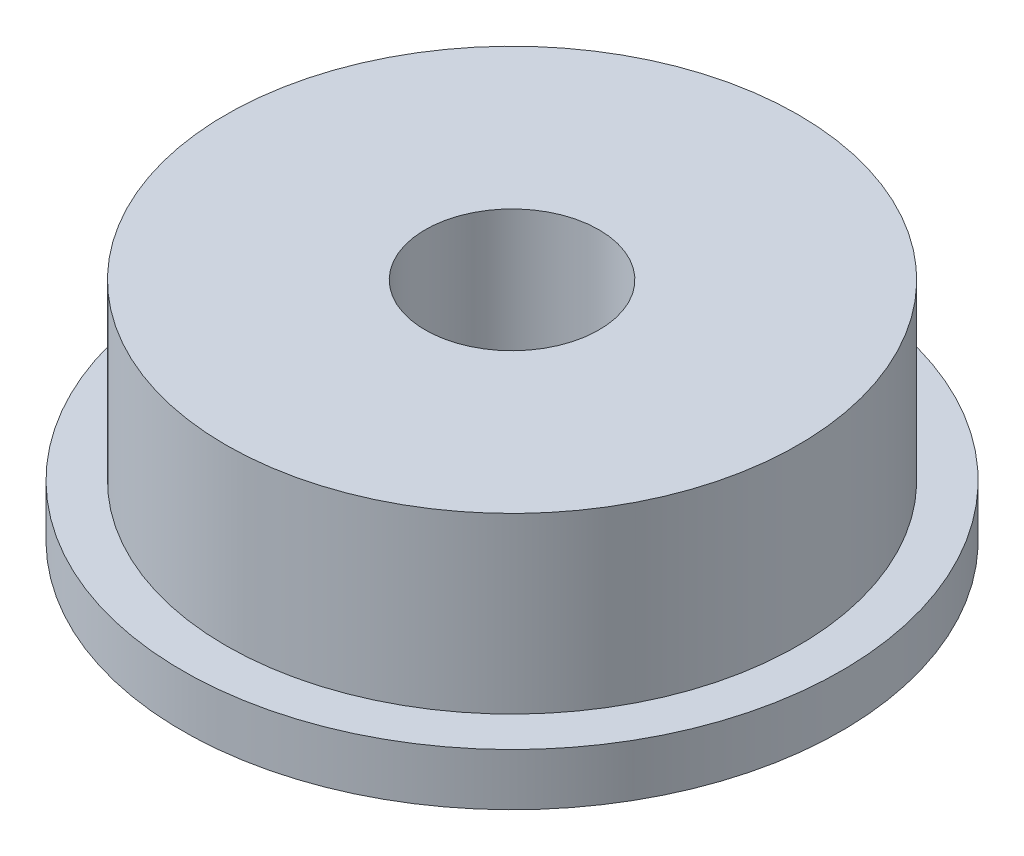
from build123d import *


with BuildPart() as part:
    # Esboço1 → Revolução1 (revolve)
    with BuildSketch(Plane.XY, mode=Mode.PRIVATE) as revolu_o1_sk:
        Polygon((1.5, 0), (1.5, 3.9), (4.94, 3.9), (4.94, 0.9), (5.69, 0.9), (5.69, 0), align=None)
    revolve(revolu_o1_sk.sketch.rotate(Axis((0, 0, 0), (0, 1, 0)), 90), axis=Axis((0, 0, 0), (0, 1, 0)))


solid = part.part
